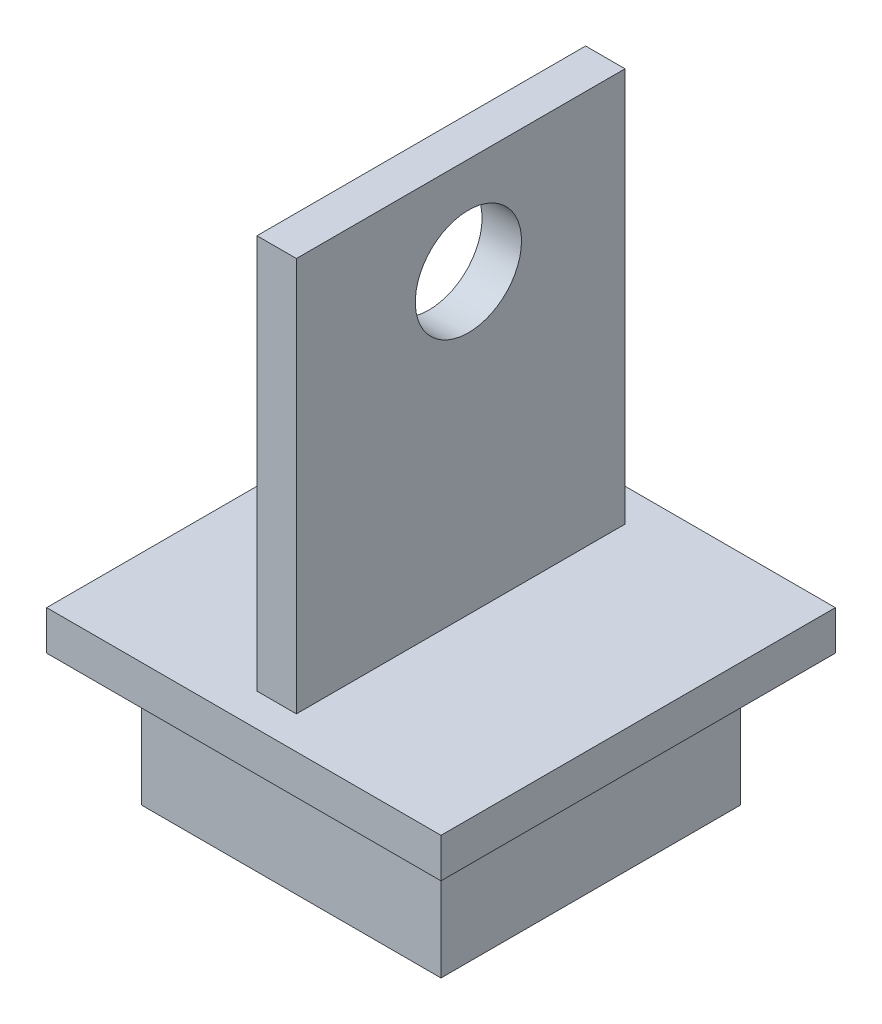
from build123d import *

# Parameters (mm, degrees)
CROQUIS1_W              = 30
CROQUIS1_H              = 30
SALIENTE_EXTRUIR1_DEPTH = 3
CROQUIS2_W              = 3
CROQUIS2_H              = 25
SALIENTE_EXTRUIR2_DEPTH = 30
CROQUIS3_R              = 4.0394072
CORTAR_EXTRUIR1_DEPTH   = 10
CROQUIS4_W              = 22.8
CROQUIS4_H              = 22.8
CROQUIS4_W_2            = 16.8
CROQUIS4_H_2            = 16.8
SALIENTE_EXTRUIR3_DEPTH = 10


with BuildPart() as part:
    # Croquis1 → Saliente-Extruir1 (new body)
    with BuildSketch(Plane(origin=(0, 0, 0), x_dir=(1, 0, 0), z_dir=(0, 1, 0))):
        Rectangle(CROQUIS1_W, CROQUIS1_H)
    extrude(amount=SALIENTE_EXTRUIR1_DEPTH)

    # Croquis2 → Saliente-Extruir2 (add)
    with BuildSketch(Plane(origin=(0, 3, 0), x_dir=(1, 0, 0), z_dir=(0, 1, 0))):
        Rectangle(CROQUIS2_W, CROQUIS2_H)
    extrude(amount=SALIENTE_EXTRUIR2_DEPTH)

    # Croquis3 → Cortar-Extruir1 (cut)
    with BuildSketch(Plane(origin=(1.5, 0, 0), x_dir=(0, 0, -1), z_dir=(1, 0, 0))):
        with Locations((0.584677198, 25.603738422)):
            Circle(CROQUIS3_R)
    extrude(amount=-CORTAR_EXTRUIR1_DEPTH, mode=Mode.SUBTRACT)

    # Croquis4 → Saliente-Extruir3 (add)
    with BuildSketch(Plane.XZ):
        Rectangle(CROQUIS4_W, CROQUIS4_H)
        Rectangle(CROQUIS4_W_2, CROQUIS4_H_2, mode=Mode.SUBTRACT)
    extrude(amount=SALIENTE_EXTRUIR3_DEPTH)


solid = part.part
